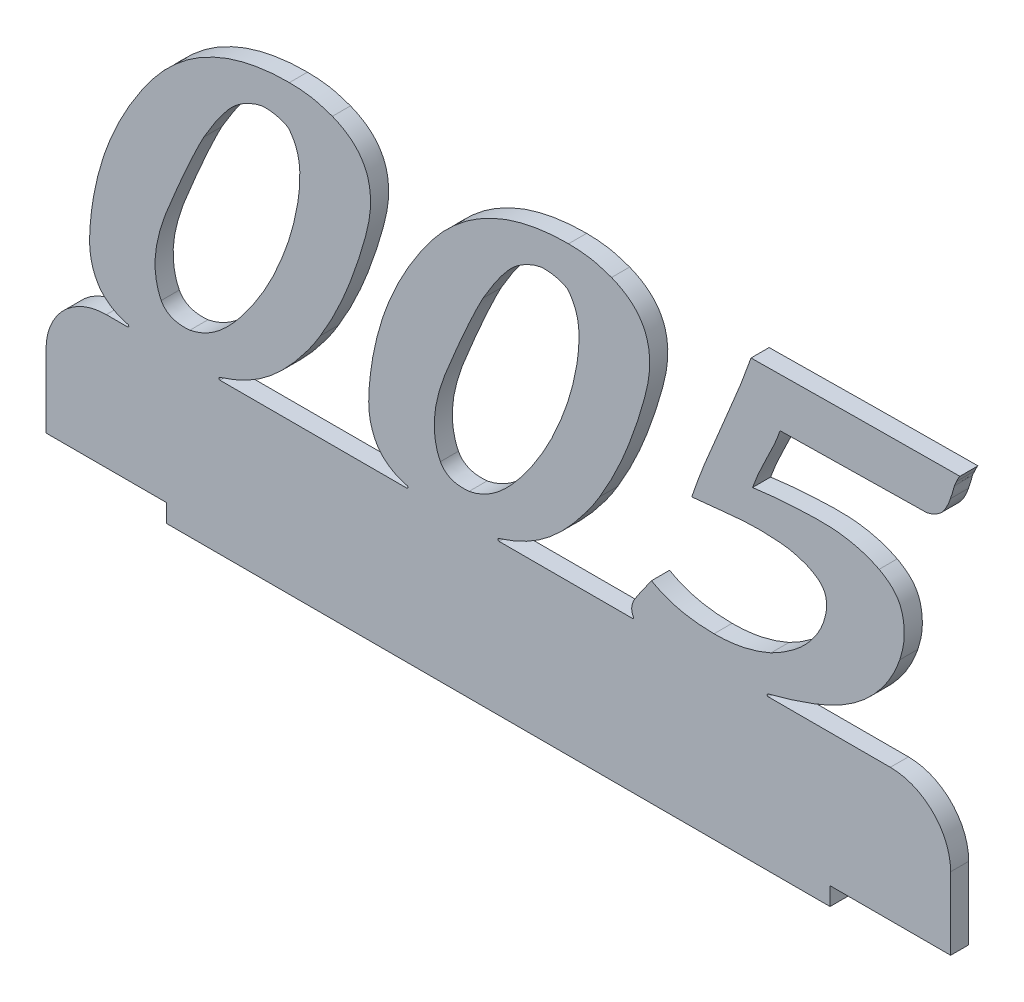
from build123d import *

# Parameters (mm, degrees)
BOSS_EXTRUDE1_DEPTH = 3
FILLET1_R           = 10
FILLET2_R           = 0.2


with BuildPart() as part:
    # Sketch1 → Boss-Extrude1 (new body)
    with BuildSketch(Plane.XY):
        with BuildLine():
            Line((122.4075168, 22.000000008), (150, 22.000001607))
            Line((150, 22.000001607), (150, 0))
            Line((150, 0), (130, 0))
            Line((130, 0), (130, -3))
            Line((130, -3), (20, -3))
            Line((20, -3), (20, 0))
            Line((20, 0), (0, 0))
            Line((0, 0), (0, 22.000000008))
            Line((0, 22.000000008), (15.157522699, 22.000000008))
            add(Edge.make_bspline(
                [(15.157522699, 22.000000008), (14.453925726, 22.152229195), (13.228392775, 22.468326266), (11.54635293, 23.060766712), (10.239967583, 23.910624932), (9.130004587, 24.929685474), (8.30013118, 26.206956322), (7.694648927, 27.678486522), (7.14102452, 30.043328704), (7.210656751, 31.963035279), (7.300999018, 33.277568545)],
                knots=[0.420874882, 0.420874882, 0.420874882, 0.420874882, 0.501387928, 0.562299825, 0.61931963, 0.674487907, 0.729675441, 0.788153341, 0.851799168, 1, 1, 1, 1], degree=3))
            add(Edge.make_bspline(
                [(7.300999018, 33.277568545), (7.467923084, 35.505664953), (7.957115954, 38.831238578), (9.086502427, 43.168042697), (10.149334822, 46.377406078), (11.503958264, 49.510743595), (13.041956489, 52.61657282), (14.849693018, 55.659721762), (16.856778094, 58.626855784), (19.05431653, 61.41620448), (21.528571336, 63.835018282), (24.17083577, 65.922649969), (27.051056024, 67.570040762), (30.08655602, 68.917882452), (34.508963697, 70.140211188), (37.987682553, 70.524925468), (40.354165554, 70.494143994)],
                knots=[0, 0, 0, 0, 0.122246067, 0.183381441, 0.245050885, 0.307031795, 0.37001055, 0.434578783, 0.500534692, 0.565957523, 0.628479512, 0.689453544, 0.749684058, 0.80955899, 0.870724503, 1, 1, 1, 1], degree=3))
            add(Edge.make_bspline(
                [(40.354165554, 70.494143994), (41.614405009, 70.483694141), (44.057244291, 70.340178209), (46.397398214, 69.630322414), (47.488645617, 69.223620148)],
                knots=[0, 0, 0, 0, 0.519885394, 1, 1, 1, 1], degree=3))
            add(Edge.make_bspline(
                [(47.488645617, 69.223620148), (48.75619303, 68.708321935), (50.551245688, 67.714971964), (52.290558355, 65.732059945), (53.200080447, 64.058585824), (53.715363029, 62.15366701), (53.880674003, 60.036621648), (53.687566566, 57.705853104), (52.938166301, 54.366445561), (51.659645954, 50.200017476), (49.358462344, 43.896437962), (47.161546161, 39.470160571), (45.494900503, 36.717756191)],
                knots=[0, 0, 0, 0, 0.111905612, 0.162582178, 0.212592743, 0.265416324, 0.321765959, 0.384451445, 0.45478123, 0.599580751, 0.738515281, 1, 1, 1, 1], degree=3))
            add(Edge.make_bspline(
                [(45.494900503, 36.717756191), (44.403416385, 34.860543908), (42.533118952, 32.290069422), (39.783767572, 29.167086312), (37.615072675, 27.097818478), (35.232640998, 25.290156023), (32.552917201, 23.794361911), (29.929413171, 22.727885271), (28.188570938, 22.19662464), (27.460839236, 22.000000008)],
                knots=[0, 0, 0, 0, 0.257859597, 0.380113614, 0.498337489, 0.61657684, 0.737567111, 0.865047578, 0.955373743, 0.955373743, 0.955373743, 0.955373743], degree=3))
            Line((27.460839236, 22.000000008), (61.44368375, 22.000000008))
            add(Edge.make_bspline(
                [(61.44368375, 22.000000008), (60.740086782, 22.152229194), (59.514553835, 22.468326268), (57.832513994, 23.060766711), (56.526128647, 23.910624932), (55.416165651, 24.929685474), (54.586292244, 26.206956322), (53.980809991, 27.678486522), (53.427185583, 30.043328704), (53.496817814, 31.963035279), (53.587160081, 33.277568545)],
                knots=[0.420874883, 0.420874883, 0.420874883, 0.420874883, 0.501387928, 0.562299825, 0.61931963, 0.674487907, 0.729675441, 0.788153341, 0.851799168, 1, 1, 1, 1], degree=3))
            add(Edge.make_bspline(
                [(53.587160081, 33.277568545), (53.754084147, 35.505664953), (54.243277017, 38.831238578), (55.37266349, 43.168042697), (56.435495885, 46.377406078), (57.790119328, 49.510743595), (59.328117552, 52.61657282), (61.135854081, 55.659721762), (63.142939157, 58.626855784), (65.340477593, 61.41620448), (67.814732399, 63.835018282), (70.456996833, 65.922649969), (73.337217088, 67.570040762), (76.372717083, 68.917882452), (80.79512476, 70.140211188), (84.273843616, 70.524925468), (86.640326617, 70.494143994)],
                knots=[0, 0, 0, 0, 0.122246067, 0.183381441, 0.245050885, 0.307031795, 0.37001055, 0.434578783, 0.500534692, 0.565957523, 0.628479512, 0.689453544, 0.749684058, 0.80955899, 0.870724503, 1, 1, 1, 1], degree=3))
            add(Edge.make_bspline(
                [(86.640326617, 70.494143994), (87.900566073, 70.483694141), (90.343405354, 70.340178209), (92.683559278, 69.630322414), (93.77480668, 69.223620148)],
                knots=[0, 0, 0, 0, 0.519885394, 1, 1, 1, 1], degree=3))
            add(Edge.make_bspline(
                [(93.77480668, 69.223620148), (95.042354094, 68.708321935), (96.837406752, 67.714971964), (98.576719418, 65.732059945), (99.48624151, 64.058585824), (100.001524092, 62.15366701), (100.166835067, 60.036621648), (99.973727629, 57.705853104), (99.224327364, 54.366445561), (97.945807017, 50.200017476), (95.644623407, 43.896437962), (93.447707224, 39.470160571), (91.781061567, 36.717756191)],
                knots=[0, 0, 0, 0, 0.111905612, 0.162582178, 0.212592743, 0.265416324, 0.321765959, 0.384451445, 0.45478123, 0.599580751, 0.738515281, 1, 1, 1, 1], degree=3))
            add(Edge.make_bspline(
                [(91.781061567, 36.717756191), (90.689577448, 34.860543908), (88.819280015, 32.290069422), (86.069928636, 29.167086312), (83.901233739, 27.097818478), (81.518802061, 25.290156023), (78.839078264, 23.794361911), (76.215574235, 22.727885271), (74.474732, 22.19662464), (73.747000298, 22.000000008)],
                knots=[0, 0, 0, 0, 0.257859597, 0.380113614, 0.498337489, 0.61657684, 0.737567111, 0.865047578, 0.955373743, 0.955373743, 0.955373743, 0.955373743], degree=3))
            Line((73.747000298, 22.000000008), (97.619056616, 22.000000008))
            add(Edge.make_bspline(
                [(97.619056616, 22.000000008), (97.495383311, 22.147535463), (97.234045438, 22.566442761), (97.043559961, 23.392965779), (97.289017541, 24.450317124), (97.916083403, 25.488714881), (98.654230537, 26.503586786), (99.463371239, 27.696193818), (100.056393017, 28.496593642), (100.401077204, 28.996880507)],
                knots=[0.046040984, 0.046040984, 0.046040984, 0.046040984, 0.113819519, 0.218197342, 0.338418704, 0.48851169, 0.646371825, 0.784334397, 1, 1, 1, 1], degree=3))
            add(Edge.make_bspline(
                [(100.401077204, 28.996880507), (101.848733307, 28.138565101), (105.245169954, 26.862583872), (108.854872595, 26.56748721), (110.760733185, 26.553565417)],
                knots=[0, 0, 0, 0, 0.467740759, 1, 1, 1, 1], degree=3))
            add(Edge.make_bspline(
                [(110.760733185, 26.553565417), (112.405810676, 26.547730496), (115.654148755, 26.847054124), (118.745897859, 27.883134946), (120.201702692, 28.52776401)],
                knots=[0, 0, 0, 0, 0.508188984, 1, 1, 1, 1], degree=3))
            add(Edge.make_bspline(
                [(120.201702692, 28.52776401), (121.282752107, 29.049673402), (122.779550929, 29.960124171), (124.601920632, 31.330297329), (125.76834333, 32.396161135), (126.779424148, 33.525687974), (127.92028351, 35.080852507), (128.597450532, 36.348405751), (128.899904413, 37.245512251)],
                knots=[0, 0, 0, 0, 0.285166795, 0.415663546, 0.541808395, 0.660345555, 0.775657586, 1, 1, 1, 1], degree=3))
            add(Edge.make_bspline(
                [(128.899904413, 37.245512251), (129.092985481, 37.874241952), (129.377814903, 38.783969195), (129.474630122, 39.990357077), (129.383122179, 40.771135877), (129.229561694, 41.484986094), (128.893120215, 42.107423472), (128.463952411, 42.665159819), (127.701499291, 43.290280896), (126.585120876, 43.945532913), (125.058774767, 44.516690921), (123.358050248, 44.96458513), (120.814779443, 45.22783356), (117.448731898, 45.35641891), (114.063635468, 45.096751823), (111.458645289, 44.797207299), (109.367267238, 44.579404148), (107.931990188, 44.455631081), (107.066440769, 44.360445793)],
                knots=[0, 0, 0, 0, 0.071404243, 0.102517896, 0.130176365, 0.156355673, 0.180967082, 0.206088886, 0.232106092, 0.287156962, 0.345457123, 0.40808307, 0.477037327, 0.621747178, 0.772340906, 0.844016801, 0.905722023, 1, 1, 1, 1], degree=3))
            add(Edge.make_bspline(
                [(107.066440769, 44.360445793), (108.474881575, 48.575058503), (111.931568929, 56.793163009), (115.452583127, 64.983250308), (116.898340691, 69.223620148)],
                knots=[0, 0, 0, 0, 0.497975483, 1, 1, 1, 1], degree=3))
            add(Edge.make_bspline(
                [(116.898340691, 69.223620148), (122.658024037, 69.291944863), (134.20344449, 69.409840948), (145.748566489, 69.565944048), (151.534775406, 69.555911)],
                knots=[0, 0, 0, 0, 0.498878118, 1, 1, 1, 1], degree=3))
            add(Edge.make_bspline(
                [(151.534775406, 69.555911), (151.20916263, 69.100614275), (151.007019346, 68.578584964)],
                knots=[0, 0, 0, 1, 1, 1], degree=2))
            add(Edge.make_bspline(
                [(151.007019346, 68.578584964), (150.888980615, 68.343212087), (150.775332751, 68.070053251), (150.612488558, 67.781322415), (150.616088932, 67.718538052)],
                knots=[0, 0, 0, 0, 0.803037268, 1, 1, 1, 1], degree=3))
            add(Edge.make_bspline(
                [(150.616088932, 67.718538052), (150.47625607, 67.25233168), (150.306596507, 66.506771812), (150.051984988, 65.786511508), (149.951507227, 65.529327732)],
                knots=[0, 0, 0, 0, 0.638073184, 1, 1, 1, 1], degree=3))
            add(Edge.make_bspline(
                [(149.951507227, 65.529327732), (149.518087289, 64.12601563), (148.622343818, 62.968733517)],
                knots=[0, 0, 0, 1, 1, 1], degree=2))
            add(Edge.make_bspline(
                [(148.622343818, 62.968733517), (147.551591374, 61.902665494), (146.061749604, 61.580930546)],
                knots=[0, 0, 0, 1, 1, 1], degree=2))
            Line((146.061749604, 61.580930546), (121.706784788, 61.190000132))
            add(Edge.make_bspline(
                [(121.706784788, 61.190000132), (121.125405106, 59.354706778), (119.386035053, 55.974369006), (117.760533504, 52.53961585), (117.15244546, 50.752158068)],
                knots=[0, 0, 0, 0, 0.504222707, 1, 1, 1, 1], degree=3))
            add(Edge.make_bspline(
                [(117.15244546, 50.752158068), (118.833851762, 50.983192006), (121.432895495, 51.240204293), (125.008161063, 51.471518475), (127.856106925, 51.578467301), (130.697737333, 51.538500716), (134.200417593, 51.048484457), (136.669135616, 50.285225428), (138.145408713, 49.501180742)],
                knots=[0, 0, 0, 0, 0.238617441, 0.367154901, 0.503750525, 0.639402589, 0.766127973, 1, 1, 1, 1], degree=3))
            add(Edge.make_bspline(
                [(138.145408713, 49.501180742), (139.132337428, 48.953137801), (140.542203817, 47.978677669), (141.688932791, 46.099619624), (142.14089607, 44.597174412), (142.321319158, 43.030689908), (142.307377075, 40.867953714), (141.902326159, 39.268008714), (141.566049839, 38.222838287)],
                knots=[0, 0, 0, 0, 0.263830967, 0.382076604, 0.502053545, 0.623420155, 0.745364216, 1, 1, 1, 1], degree=3))
            add(Edge.make_bspline(
                [(141.566049839, 38.222838287), (141.013728224, 36.677974529), (139.954606264, 34.435924468), (137.955639017, 31.83995808), (136.264535806, 30.030475617), (134.298534153, 28.416213182), (132.092381766, 26.959773758), (129.638893321, 25.690366741), (126.983958158, 24.63381605), (124.264942143, 23.693071249), (121.577893934, 22.873457695), (119.530390438, 22.335606823), (118.385635267, 22.063326238), (118.112309651, 22.000000008)],
                knots=[0, 0, 0, 0, 0.120139222, 0.179293704, 0.238927503, 0.300823558, 0.364758517, 0.431861411, 0.502352241, 0.573447082, 0.642150155, 0.707651873, 0.728160141, 0.728160141, 0.728160141, 0.728160141], degree=3))
            Line((118.112309651, 22.000000008), (122.4075168, 22.000000008))
        make_face()
        with BuildLine():
            add(Edge.make_bspline(
                [(40.217339909, 63.887419991), (39.616079943, 64.296937141), (38.150791637, 64.803081336), (36.612995597, 64.930376472), (35.799826227, 64.884292548)],
                knots=[0, 0, 0, 0, 0.469698931, 1, 1, 1, 1], degree=3))
            add(Edge.make_bspline(
                [(35.799826227, 64.884292548), (34.655124955, 64.643604046), (33.037086047, 63.96607574), (31.148699103, 62.588509992), (28.840792425, 60.010449717), (27.307094662, 57.558865669), (26.163391512, 55.580148685)],
                knots=[0, 0, 0, 0, 0.252589616, 0.375811021, 0.503770371, 1, 1, 1, 1], degree=3))
            add(Edge.make_bspline(
                [(26.163391512, 55.580148685), (25.707112696, 54.782092931), (25.108892882, 53.465527305), (24.217379721, 51.646464946), (23.50391206, 50.064916997), (22.739530536, 48.345688513), (21.939043232, 46.478959669), (21.082444433, 44.482751567), (20.210380416, 42.394429859), (19.417391924, 40.296253864), (18.785736216, 38.268900678), (18.344930676, 36.361806974), (18.102029191, 34.56876313), (18.054715363, 32.8894786), (18.256419534, 30.863779394), (18.67592754, 29.440122042), (19.107097532, 28.586403572)],
                knots=[0, 0, 0, 0, 0.095871325, 0.150956838, 0.211549603, 0.277044413, 0.347448488, 0.423659813, 0.503898773, 0.583776288, 0.6578152, 0.725493304, 0.78794858, 0.846481479, 0.900510454, 1, 1, 1, 1], degree=3))
            add(Edge.make_bspline(
                [(19.107097532, 28.586403572), (19.465544374, 27.843386554), (20.96501843, 26.636111072), (22.877919476, 26.619522821), (23.856902067, 26.690391062)],
                knots=[0, 0, 0, 0, 0.446153942, 1, 1, 1, 1], degree=3))
            add(Edge.make_bspline(
                [(23.856902067, 26.690391062), (25.314426565, 26.964746271), (27.471021833, 27.983166836), (30.003323351, 30.150936368), (31.9537853, 32.308128946), (33.820584339, 34.793648118), (35.582110105, 37.467649914), (37.172558243, 40.294136512), (38.567086162, 43.250384513), (39.76523633, 46.267368972), (40.756771309, 49.279430821), (41.475453198, 52.267927675), (41.979990407, 55.158531023), (42.149607226, 57.860286279), (41.947741092, 60.890849444), (41.07289448, 62.879400908), (40.217339909, 63.887419991)],
                knots=[0, 0, 0, 0, 0.099522769, 0.157975555, 0.224341199, 0.295661745, 0.367825167, 0.440561069, 0.514605516, 0.588508481, 0.659789613, 0.728660389, 0.796041852, 0.857776262, 0.9112652, 1, 1, 1, 1], degree=3))
        make_face(mode=Mode.SUBTRACT)
        with BuildLine():
            add(Edge.make_bspline(
                [(86.503500972, 63.887419991), (85.902241006, 64.296937141), (84.4369527, 64.803081336), (82.89915666, 64.930376472), (82.08598729, 64.884292548)],
                knots=[0, 0, 0, 0, 0.469698931, 1, 1, 1, 1], degree=3))
            add(Edge.make_bspline(
                [(82.08598729, 64.884292548), (80.941286018, 64.643604046), (79.32324711, 63.96607574), (77.434860166, 62.588509992), (75.126953488, 60.010449717), (73.593255725, 57.558865669), (72.449552575, 55.580148685)],
                knots=[0, 0, 0, 0, 0.252589616, 0.375811021, 0.503770371, 1, 1, 1, 1], degree=3))
            add(Edge.make_bspline(
                [(72.449552575, 55.580148685), (71.99327376, 54.782092931), (71.395053946, 53.465527305), (70.503540784, 51.646464946), (69.790073123, 50.064916997), (69.025691599, 48.345688513), (68.225204296, 46.478959669), (67.368605496, 44.482751567), (66.496541479, 42.394429859), (65.703552987, 40.296253864), (65.07189728, 38.268900678), (64.631091739, 36.361806974), (64.388190254, 34.56876313), (64.340876426, 32.8894786), (64.542580597, 30.863779394), (64.962088603, 29.440122042), (65.393258596, 28.586403572)],
                knots=[0, 0, 0, 0, 0.095871325, 0.150956838, 0.211549603, 0.277044413, 0.347448488, 0.423659813, 0.503898773, 0.583776288, 0.6578152, 0.725493304, 0.78794858, 0.846481479, 0.900510454, 1, 1, 1, 1], degree=3))
            add(Edge.make_bspline(
                [(65.393258596, 28.586403572), (65.751705437, 27.843386554), (67.251179493, 26.636111072), (69.16408054, 26.619522821), (70.14306313, 26.690391062)],
                knots=[0, 0, 0, 0, 0.446153942, 1, 1, 1, 1], degree=3))
            add(Edge.make_bspline(
                [(70.14306313, 26.690391062), (71.600587628, 26.964746271), (73.757182897, 27.983166836), (76.289484414, 30.150936368), (78.239946364, 32.308128946), (80.106745402, 34.793648118), (81.868271169, 37.467649914), (83.458719306, 40.294136512), (84.853247225, 43.250384513), (86.051397393, 46.267368972), (87.042932372, 49.279430821), (87.761614262, 52.267927675), (88.26615147, 55.158531023), (88.43576829, 57.860286279), (88.233902155, 60.890849444), (87.359055544, 62.879400908), (86.503500972, 63.887419991)],
                knots=[0, 0, 0, 0, 0.099522769, 0.157975555, 0.224341199, 0.295661745, 0.367825167, 0.440561069, 0.514605516, 0.588508481, 0.659789613, 0.728660389, 0.796041852, 0.857776262, 0.9112652, 1, 1, 1, 1], degree=3))
        make_face(mode=Mode.SUBTRACT)
    extrude(amount=BOSS_EXTRUDE1_DEPTH)

    # Fillet1
    fillet1_edges = [part.edges().sort_by_distance(p)[0] for p in [
        (150, 22.000001607, 1.5),
        (0, 22.000000008, 1.5),
    ]]
    fillet(fillet1_edges, radius=FILLET1_R)

    # Fillet2
    fillet2_edges = [part.edges().sort_by_distance(p)[0] for p in [
        (97.619056616, 22.000000008, 1.5),
        (61.44368375, 22.000000008, 1.5),
        (15.157522699, 22.000000008, 1.5),
        (27.460839236, 22.000000008, 1.5),
        (73.747000298, 22.000000008, 1.5),
        (118.112309651, 22.000000008, 1.5),
    ]]
    fillet(fillet2_edges, radius=FILLET2_R)


solid = part.part
